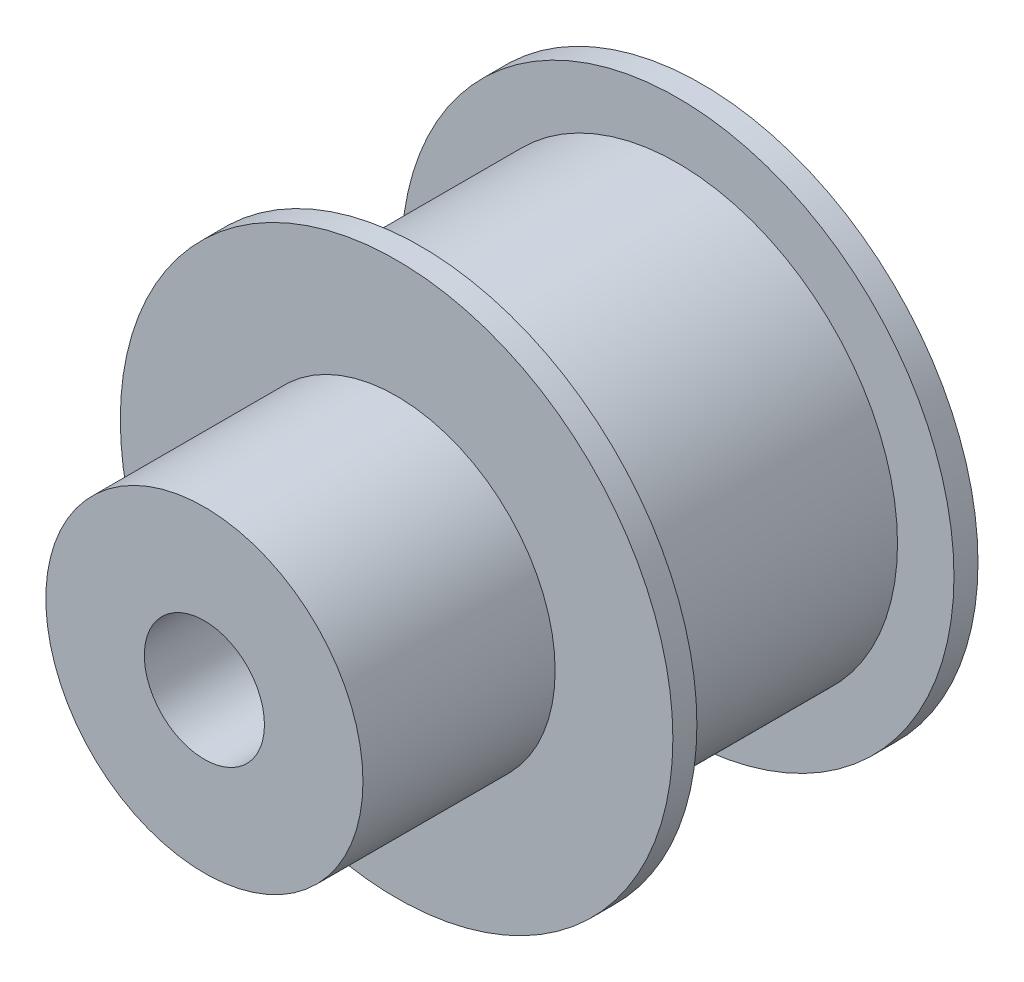
from build123d import *

# Parameters (mm, degrees)
SKETCH_1_R          = 11.5
EXTRUDE_1_DEPTH     = 1
SKETCH_2_R          = 9.15
EXTRUDE_2_DEPTH     = 10.7
SKETCH_3_R          = 11.5
EXTRUDE_3_DEPTH     = 1
SKETCH_4_R          = 6.6
EXTRUDE_4_DEPTH     = 8
SKETCH_5_R          = 2.5
CUT_EXTRUDE_1_DEPTH = 27.324703227


with BuildPart() as part:
    # Эскиз1 → Бобышка-Вытянуть1 (new body)
    with BuildSketch(Plane.XY):
        Circle(SKETCH_1_R)
    extrude(amount=EXTRUDE_1_DEPTH)

    # Эскиз2 → Бобышка-Вытянуть2 (add)
    with BuildSketch(Plane.XY.offset(1)):
        Circle(SKETCH_2_R)
    extrude(amount=EXTRUDE_2_DEPTH)

    # Эскиз3 → Бобышка-Вытянуть3 (add)
    with BuildSketch(Plane.XY.offset(11.7)):
        Circle(SKETCH_3_R)
    extrude(amount=EXTRUDE_3_DEPTH)

    # Эскиз4 → Бобышка-Вытянуть4 (add)
    with BuildSketch(Plane.XY.offset(12.7)):
        Circle(SKETCH_4_R)
    extrude(amount=EXTRUDE_4_DEPTH)

    # Эскиз5 → Вырез-Вытянуть1 (cut, through all)
    with BuildSketch(Plane.XY.offset(20.7)):
        Circle(SKETCH_5_R)
    extrude(amount=-CUT_EXTRUDE_1_DEPTH, mode=Mode.SUBTRACT)


solid = part.part
